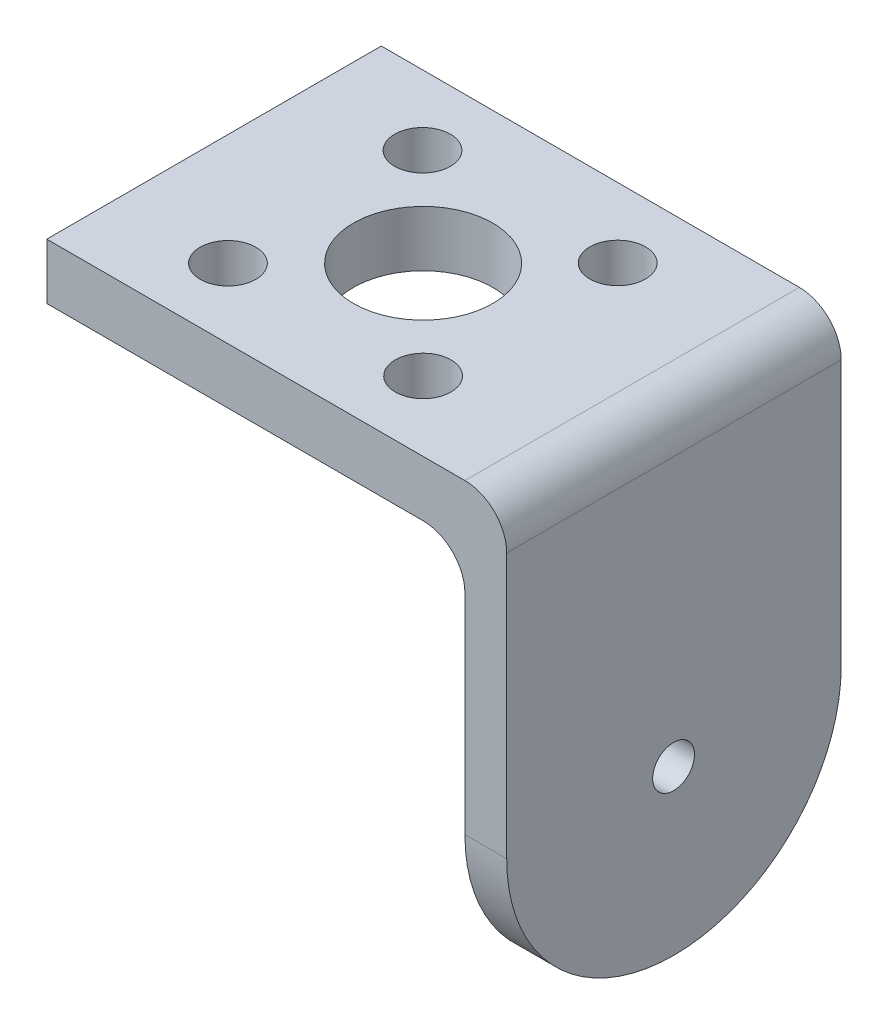
from build123d import *

# Parameters (mm, degrees)
EXTRUDE_1_DEPTH          = 24
CUT_EXTRUDE_2_DEPTH      = 54.111509792
CUT_EXTRUDE_2_DEPTH_BACK = 40
CUT_EXTRUDE_START        = -40
CUT_EXTRUDE_3_DEPTH      = 40
SKETCH_8_R               = 2
SKETCH_8_R_2             = 5
CUT_EXTRUDE_4_DEPTH      = 40
SKETCH_9_R               = 1.5
CUT_EXTRUDE_5_DEPTH      = 10


with BuildPart() as part:
    # 草图1 → 凸台-拉伸1 (new body)
    with BuildSketch(Plane.XY):
        with BuildLine():
            Line((30, -7), (30, -34))
            Line((30, -34), (32.997461605, -34))
            Line((32.997461605, -34), (32.997461605, -3))
            ThreePointArc((32.997461605, -3), (32.118781948, -0.878679656), (29.997461605, 0))
            Line((29.997461605, 0), (0, 0))
            Line((0, 0), (0, -4))
            Line((0, -4), (27, -4))
            ThreePointArc((27, -4), (29.121320344, -4.878679656), (30, -7))
        make_face()
    extrude(amount=EXTRUDE_1_DEPTH)

    # 草图4 → 切除-拉伸2 (cut, two sides: drawn at the far end of the back side and taken through both)
    with BuildSketch(Plane(origin=(32.997461605, 0, 0), x_dir=(0, 0, -1), z_dir=(1, 0, 0)).offset(-CUT_EXTRUDE_2_DEPTH_BACK)):
        with BuildLine():
            Line((-24, -34), (-12, -34))
            ThreePointArc((-12, -34), (-20.485281374, -30.485281374), (-24, -22))
            Line((-24, -22), (-24, -34))
        make_face()
    extrude(amount=CUT_EXTRUDE_2_DEPTH + CUT_EXTRUDE_2_DEPTH_BACK, mode=Mode.SUBTRACT)

    # 草图7 → 切除-拉伸3 (cut)
    with BuildSketch(Plane(origin=(32.997461605, 0, 0), x_dir=(0, 0, -1), z_dir=(1, 0, 0)).offset(CUT_EXTRUDE_START)):
        with BuildLine():
            Line((0, -34), (0, -22))
            ThreePointArc((0, -22), (-3.514718626, -30.485281374), (-12, -34))
            Line((-12, -34), (0, -34))
        make_face()
    extrude(amount=CUT_EXTRUDE_3_DEPTH, mode=Mode.SUBTRACT)

    # 草图8 → 切除-拉伸4 (cut)
    with BuildSketch(Plane(origin=(0, 0, 0), x_dir=(1, 0, 0), z_dir=(0, 1, 0))):
        with Locations(Location((7.95757976, -5.000064267, 0), (0, 0, 270))):
            Circle(SKETCH_8_R)
        with Locations(Location((22, -19, 0), (0, 0, 270))):
            Circle(SKETCH_8_R)
        with Locations(Location((21.95757976, -5.000064267, 0), (0, 0, 270))):
            Circle(SKETCH_8_R)
        with Locations(Location((15, -12, 0), (0, 0, 270))):
            Circle(SKETCH_8_R_2)
        with Locations(Location((8, -19, 0), (0, 0, 270))):
            Circle(SKETCH_8_R)
    extrude(amount=-CUT_EXTRUDE_4_DEPTH, mode=Mode.SUBTRACT)

    # 草图9 → 切除-拉伸5 (cut)
    with BuildSketch(Plane(origin=(32.997461605, 0, 0), x_dir=(0, 0, -1), z_dir=(1, 0, 0))):
        with Locations((-12.027919591, -22.255700116)):
            Circle(SKETCH_9_R)
    extrude(amount=-CUT_EXTRUDE_5_DEPTH, mode=Mode.SUBTRACT)


solid = part.part
